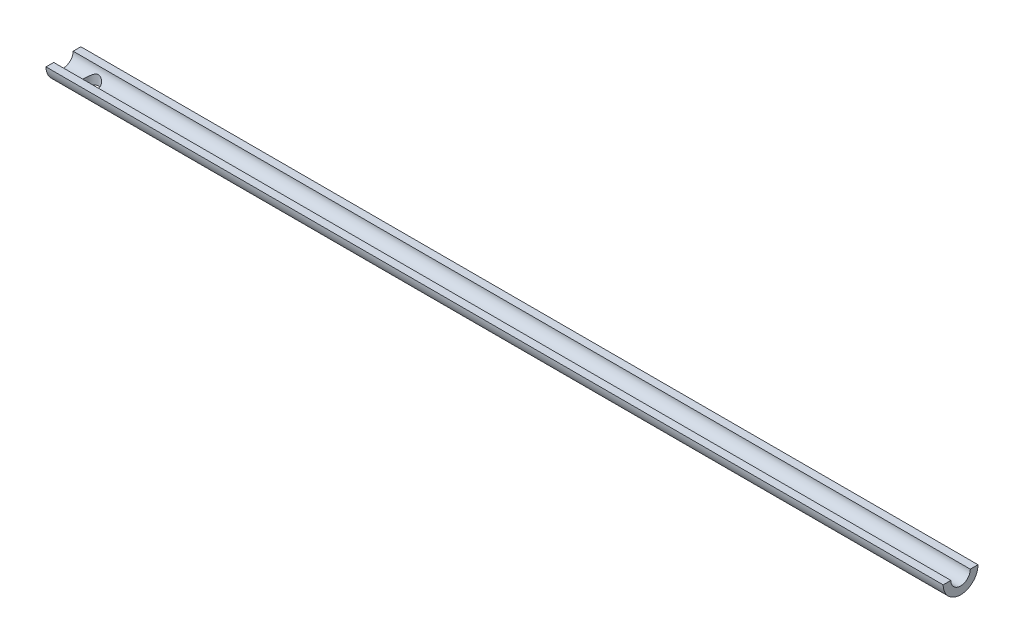
from build123d import *

# Parameters (mm, degrees)
SKETCH1_W                     = 735.584
SKETCH1_H                     = 38.1
WOOD_BLOCK_DEPTH              = 19.05
SKETCH2_R                     = 7.9756
INNER_BORE_DEPTH              = 737.816349952
SKETCH3_R                     = 6.3881
MOUTHPIECE_THROUGH_HOLE_DEPTH = 737.816349952
SKETCH5_R                     = 8.128
COUNTERBORE_DEPTH             = 5.5499
SKETCH4_OUTSIDE_W             = 187.464
SKETCH4_OUTSIDE_H             = 168.414
SKETCH4_OUTSIDE_R             = 14.2875
OUTER_DIAMETER_DEPTH          = 737.816350054


with BuildPart() as part:
    # Sketch1 → wood block (new body)
    with BuildSketch(Plane(origin=(0, 0, 0), x_dir=(1, 0, 0), z_dir=(0, 1, 0))):
        with Locations((367.792, 19.05)):
            Rectangle(SKETCH1_W, SKETCH1_H)
    extrude(amount=WOOD_BLOCK_DEPTH)

    # Sketch2 → inner bore (cut, through all)
    with BuildSketch(Plane(origin=(735.584, 0, 0), x_dir=(0, 0, -1), z_dir=(1, 0, 0))):
        with Locations((19.05, 19.05)):
            Circle(SKETCH2_R)
    extrude(amount=-INNER_BORE_DEPTH, mode=Mode.SUBTRACT)

    # Sketch3 → mouthpiece through hole (cut, through all)
    with BuildSketch(Plane(origin=(0, 0, 0), x_dir=(1, 0, 0), z_dir=(0, 1, 0))):
        with Locations(Location((22.225, 19.05, 0), (0, 0, 90))):
            Circle(SKETCH3_R)
    extrude(amount=MOUTHPIECE_THROUGH_HOLE_DEPTH, mode=Mode.SUBTRACT)

    # Sketch5 → counterbore (cut)
    with BuildSketch(Plane.XZ):
        with Locations(Location((22.225, -19.05, 0), (0, 0, 270))):
            Circle(SKETCH5_R)
    extrude(amount=-COUNTERBORE_DEPTH, mode=Mode.SUBTRACT)

    # Sketch4 outside → outer diameter (cut, through all)
    with BuildSketch(Plane.ZY):
        with Locations((-19.05, 9.525)):
            Rectangle(SKETCH4_OUTSIDE_W, SKETCH4_OUTSIDE_H)
        with Locations((-19.05, 19.05)):
            Circle(SKETCH4_OUTSIDE_R, mode=Mode.SUBTRACT)
    extrude(amount=-OUTER_DIAMETER_DEPTH, mode=Mode.SUBTRACT)


solid = part.part
